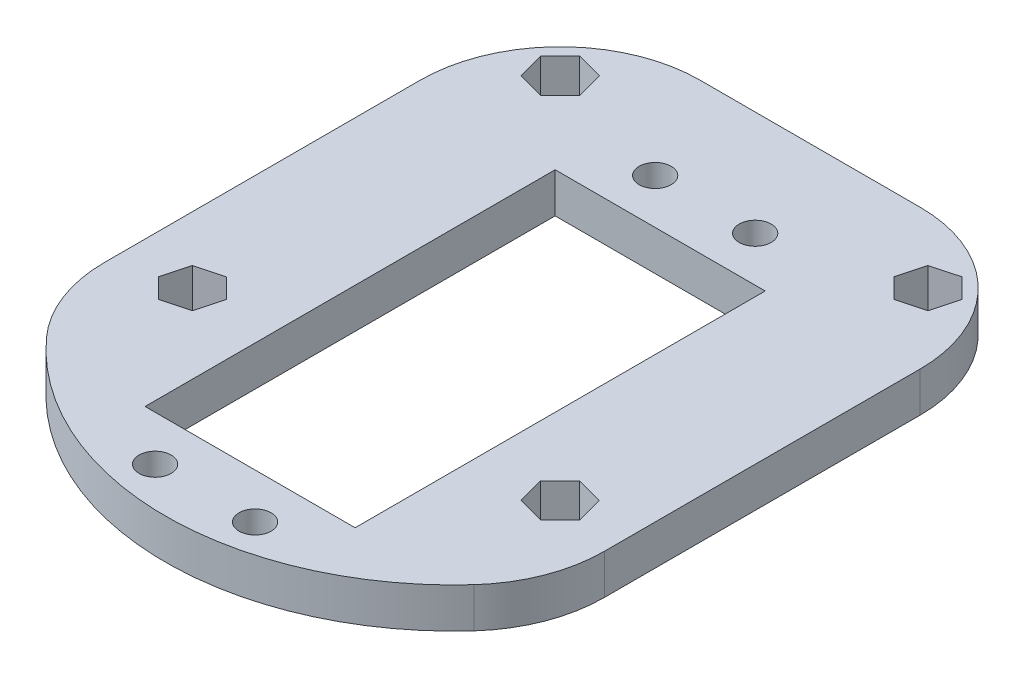
from build123d import *

# Parameters (mm, degrees)
SKETCH_1_W          = 50
SKETCH_1_H          = 50
EXTRUDE_1_DEPTH     = 4
SKETCH_2_R          = 1.6
EXTRUDE_2_DEPTH     = 4
SKETCH_2_3_W        = 21
SKETCH_2_3_H        = 35
SKETCH_2_3_R        = 1.6
CUT_EXTRUDE_1_DEPTH = 4
FILLET_1_R          = 14
FILLET_2_R          = 14


with BuildPart() as part:
    # 草图1 → 凸台-拉伸1 (new body)
    with BuildSketch(Plane(origin=(0, 0, 0), x_dir=(1, 0, 0), z_dir=(0, 1, 0))):
        Rectangle(SKETCH_1_W, SKETCH_1_H)
        Polygon((15.708195736, 17.66756085), (17.667918398, 15.708099932), (20.344722661, 16.425539082), (21.061804264, 19.10243915), (19.102081602, 21.061900068), (16.425277339, 20.344460918), align=None, mode=Mode.SUBTRACT)
        Polygon((-17.66756085, 15.708195736), (-15.708099932, 17.667918398), (-16.425539082, 20.344722661), (-19.10243915, 21.061804264), (-21.061900068, 19.102081602), (-20.344460918, 16.425277339), align=None, mode=Mode.SUBTRACT)
        Polygon((17.66756085, -15.708195736), (15.708099932, -17.667918398), (16.425539082, -20.344722661), (19.10243915, -21.061804264), (21.061900068, -19.102081602), (20.344460918, -16.425277339), align=None, mode=Mode.SUBTRACT)
        Polygon((-15.708195736, -17.66756085), (-17.667918398, -15.708099932), (-20.344722661, -16.425539082), (-21.061804264, -19.10243915), (-19.102081602, -21.061900068), (-16.425277339, -20.344460918), align=None, mode=Mode.SUBTRACT)
    extrude(amount=EXTRUDE_1_DEPTH)

    # 草图2 → 凸台-拉伸2 (add)
    with BuildSketch(Plane.XZ):
        with BuildLine():
            ThreePointArc((25, 25), (0, 39.469136454), (-25, 25))
            Line((-25, 25), (-10.5, 25))
            Line((-10.5, 25), (-10.5, 31))
            Line((-10.5, 31), (10.5, 31))
            Line((10.5, 31), (10.5, 25))
            Line((10.5, 25), (25, 25))
        make_face()
        with Locations((-5, 35.5)):
            Circle(SKETCH_2_R, mode=Mode.SUBTRACT)
        with Locations((5, 35.5)):
            Circle(SKETCH_2_R, mode=Mode.SUBTRACT)
    extrude(amount=-EXTRUDE_2_DEPTH)

    # 草图2<3> → 切除-拉伸1 (cut)
    with BuildSketch(Plane.XZ):
        with Locations((0, 7.5)):
            Rectangle(SKETCH_2_3_W, SKETCH_2_3_H)
        with Locations((-5, -14.5)):
            Circle(SKETCH_2_3_R)
        with Locations((5, -14.5)):
            Circle(SKETCH_2_3_R)
    extrude(amount=-CUT_EXTRUDE_1_DEPTH, mode=Mode.SUBTRACT)

    # 圆角1
    fillet_1_edges = [part.edges().sort_by_distance(p)[0] for p in [
        (25, 2, -25),
        (-25, 2, -25),
    ]]
    fillet(fillet_1_edges, radius=FILLET_1_R)

    # 圆角2
    fillet_2_edges = [part.edges().sort_by_distance(p)[0] for p in [
        (25, 2, 25),
        (-25, 2, 25),
    ]]
    fillet(fillet_2_edges, radius=FILLET_2_R)


solid = part.part
